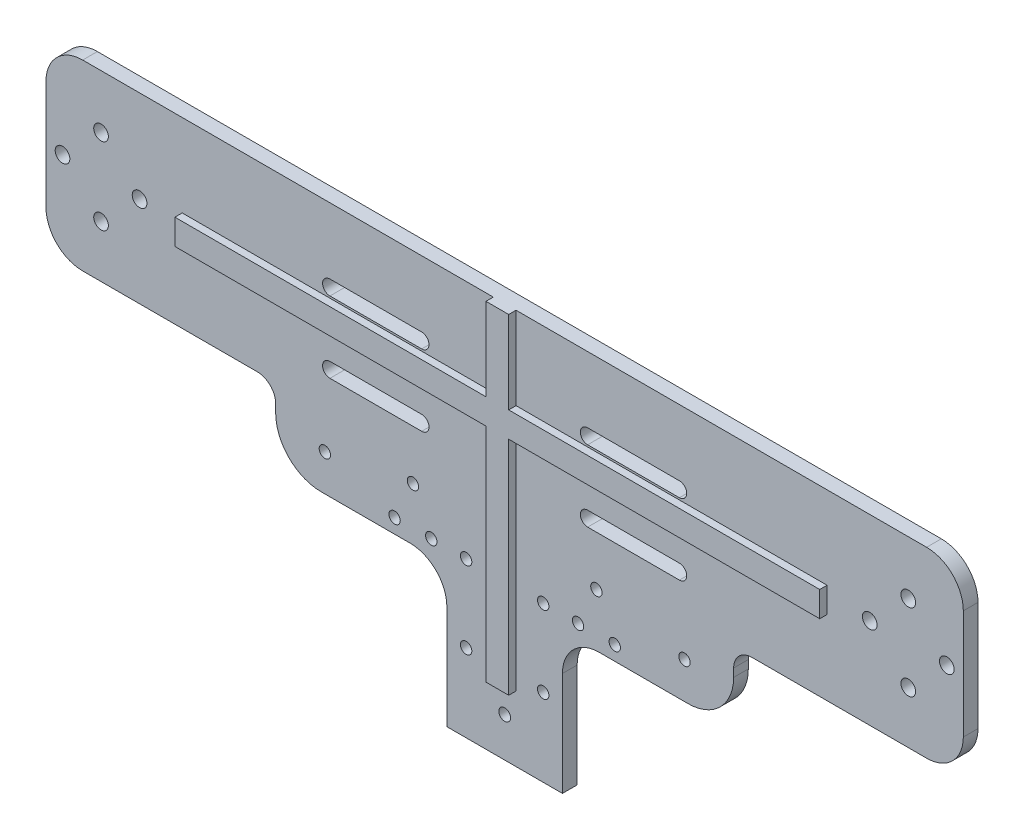
from build123d import *

# Parameters (mm, degrees)
SKETCH_1_R      = 1.55
SKETCH_1_R_2    = 1.6
SKETCH_1_R_3    = 1.546583653
SKETCH_1_R_4    = 2
EXTRUDE_1_DEPTH = 4
EXTRUDE_2_DEPTH = 2


with BuildPart() as part:
    # 草图1 → 凸台-拉伸1 (new body)
    with BuildSketch(Plane.XY):
        with BuildLine():
            Line((-93.257786629, 4.43161967), (-67.403754616, 4.43161967))
            ThreePointArc((-67.403754616, 4.43161967), (-63.86822071, 2.967153575), (-62.403754616, -0.56838033))
            Line((-62.403754616, -0.56838033), (-62.403754616, -2.789641507))
            ThreePointArc((-62.403754616, -2.789641507), (-58.770779001, -11.560420508), (-50, -15.193396123))
            Line((-50, -15.193396123), (-25.75, -15.193396123))
            ThreePointArc((-25.75, -15.193396123), (-18.678932188, -18.122328311), (-15.75, -25.193396123))
            Line((-15.75, -25.193396123), (-15.75, -53.504719017))
            Line((-15.75, -53.504719017), (15.75, -53.504719017))
            Line((15.75, -53.504719017), (15.75, -25.193396123))
            ThreePointArc((15.75, -25.193396123), (18.678932188, -18.122328311), (25.75, -15.193396123))
            Line((25.75, -15.193396123), (50, -15.193396123))
            ThreePointArc((50, -15.193396123), (58.770779001, -11.560420508), (62.403754616, -2.789641507))
            Line((62.403754616, -2.789641507), (62.403754616, -0.56838033))
            ThreePointArc((62.403754616, -0.56838033), (63.86822071, 2.967153575), (67.403754616, 4.43161967))
            Line((67.403754616, 4.43161967), (93.257786629, 4.43161967))
            Line((93.257786629, 4.43161967), (115, 4.43161967))
            ThreePointArc((115, 4.43161967), (122.071067812, 7.360551858), (125, 14.43161967))
            Line((125, 14.43161967), (125, 44.220324858))
            ThreePointArc((125, 44.220324858), (122.071067812, 51.29139267), (115, 54.220324858))
            Line((115, 54.220324858), (95.550812853, 54.220324858))
            Line((95.550812853, 54.220324858), (-95.550812853, 54.220324858))
            Line((-95.550812853, 54.220324858), (-115, 54.220324858))
            ThreePointArc((-115, 54.220324858), (-122.071067812, 51.29139267), (-125, 44.220324858))
            Line((-125, 44.220324858), (-125, 14.43161967))
            ThreePointArc((-125, 14.43161967), (-122.071067812, 7.360551858), (-115, 4.43161967))
            Line((-115, 4.43161967), (-93.257786629, 4.43161967))
        make_face()
        with Locations((-10.5, -32.252284296)):
            Circle(SKETCH_1_R, mode=Mode.SUBTRACT)
        with Locations((-49, -5.252284296)):
            Circle(SKETCH_1_R, mode=Mode.SUBTRACT)
        with Locations((-30, -11.252284296)):
            Circle(SKETCH_1_R, mode=Mode.SUBTRACT)
        with Locations((-20, -11.252284296)):
            Circle(SKETCH_1_R, mode=Mode.SUBTRACT)
        with Locations((-10.5, -11.252284296)):
            Circle(SKETCH_1_R, mode=Mode.SUBTRACT)
        with Locations((-25, -0.752284296)):
            Circle(SKETCH_1_R, mode=Mode.SUBTRACT)
        with Locations((0, -42.752284296)):
            Circle(SKETCH_1_R_2, mode=Mode.SUBTRACT)
        with Locations((10.5, -32.252284296)):
            Circle(SKETCH_1_R, mode=Mode.SUBTRACT)
        with Locations((0, -21.748867949)):
            Circle(SKETCH_1_R_3, mode=Mode.SUBTRACT)
        with Locations((10.5, -11.252284296)):
            Circle(SKETCH_1_R, mode=Mode.SUBTRACT)
        with Locations((20, -11.252284296)):
            Circle(SKETCH_1_R, mode=Mode.SUBTRACT)
        with Locations((30, -11.252284296)):
            Circle(SKETCH_1_R, mode=Mode.SUBTRACT)
        with Locations((0, -0.752284296)):
            Circle(SKETCH_1_R, mode=Mode.SUBTRACT)
        with Locations((25, -0.752284296)):
            Circle(SKETCH_1_R, mode=Mode.SUBTRACT)
        with Locations((49, -5.252284296)):
            Circle(SKETCH_1_R, mode=Mode.SUBTRACT)
        with Locations((-110, 18.626388225)):
            Circle(SKETCH_1_R_4, mode=Mode.SUBTRACT)
        with BuildLine():
            ThreePointArc((-47.619318323, 12.788573549), (-49.619318323, 14.788573549), (-47.619318323, 16.788573549))
            Line((-47.619318323, 16.788573549), (-22.619318323, 16.788573549))
            ThreePointArc((-22.619318323, 16.788573549), (-20.619318323, 14.788573549), (-22.619318323, 12.788573549))
            Line((-22.619318323, 12.788573549), (-47.619318323, 12.788573549))
        make_face(mode=Mode.SUBTRACT)
        with Locations((-120.5, 29.126388225)):
            Circle(SKETCH_1_R_4, mode=Mode.SUBTRACT)
        with Locations((-99.5, 29.126388225)):
            Circle(SKETCH_1_R_4, mode=Mode.SUBTRACT)
        with Locations((-110, 39.626388225)):
            Circle(SKETCH_1_R_4, mode=Mode.SUBTRACT)
        with BuildLine():
            ThreePointArc((-47.619318323, 32.223901574), (-49.619318323, 34.223901574), (-47.619318323, 36.223901574))
            Line((-47.619318323, 36.223901574), (-22.619318323, 36.223901574))
            ThreePointArc((-22.619318323, 36.223901574), (-20.619318323, 34.223901574), (-22.619318323, 32.223901574))
            Line((-22.619318323, 32.223901574), (-47.619318323, 32.223901574))
        make_face(mode=Mode.SUBTRACT)
        with BuildLine():
            Line((22.619318323, 16.788573549), (47.619318323, 16.788573549))
            ThreePointArc((47.619318323, 16.788573549), (49.619318323, 14.788573549), (47.619318323, 12.788573549))
            Line((47.619318323, 12.788573549), (22.619318323, 12.788573549))
            ThreePointArc((22.619318323, 12.788573549), (20.619318323, 14.788573549), (22.619318323, 16.788573549))
        make_face(mode=Mode.SUBTRACT)
        with Locations((110, 18.626388225)):
            Circle(SKETCH_1_R_4, mode=Mode.SUBTRACT)
        with BuildLine():
            Line((22.619318323, 36.223901574), (47.619318323, 36.223901574))
            ThreePointArc((47.619318323, 36.223901574), (49.619318323, 34.223901574), (47.619318323, 32.223901574))
            Line((47.619318323, 32.223901574), (22.619318323, 32.223901574))
            ThreePointArc((22.619318323, 32.223901574), (20.619318323, 34.223901574), (22.619318323, 36.223901574))
        make_face(mode=Mode.SUBTRACT)
        with Locations((99.5, 29.126388225)):
            Circle(SKETCH_1_R_4, mode=Mode.SUBTRACT)
        with Locations((120.5, 29.126388225)):
            Circle(SKETCH_1_R_4, mode=Mode.SUBTRACT)
        with Locations((110, 39.626388225)):
            Circle(SKETCH_1_R_4, mode=Mode.SUBTRACT)
    extrude(amount=EXTRUDE_1_DEPTH)

    # 草图2 → 凸台-拉伸2 (add)
    with BuildSketch(Plane.XY.offset(4)):
        Polygon((3.098482938, -35.658654768), (-3.098482938, -35.658654768), (-3.098482938, 24.781778974), (-87.869942148, 24.781778974), (-87.869942148, 31.693824975), (-3.098482938, 31.693824975), (-3.098482938, 54.220324858), (3.098482938, 54.220324858), (3.098482938, 31.693824975), (87.869942148, 31.693824975), (87.869942148, 24.781778974), (3.098482938, 24.781778974), align=None)
    extrude(amount=EXTRUDE_2_DEPTH)


solid = part.part
